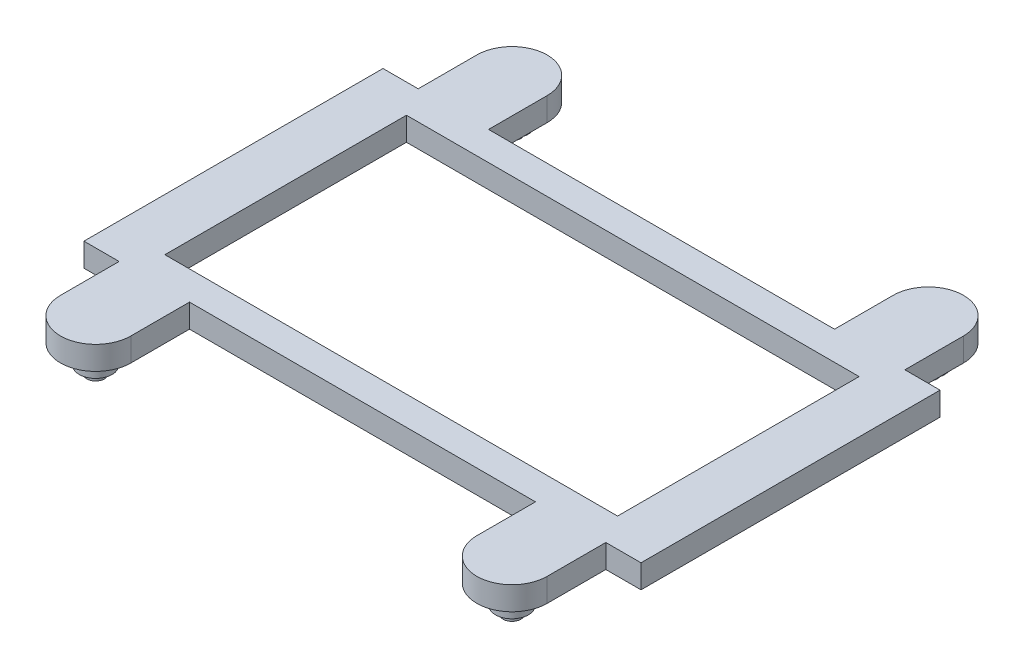
from build123d import *

# Parameters (mm, degrees)
EXTRUDE_1_DEPTH     = 4
SKETCH_4_R          = 2.8
EXTRUDE_2_DEPTH     = 3.3
EXTRUDE_2_2_DEPTH   = 3.3
EXTRUDE_2_3_DEPTH   = 3.3
EXTRUDE_2_4_DEPTH   = 3.3
SKETCH_5_R          = 1.5
EXTRUDE_3_DEPTH     = 1.3
EXTRUDE_3_2_DEPTH   = 1.3
EXTRUDE_3_3_DEPTH   = 1.3
EXTRUDE_3_4_DEPTH   = 1.3
SKETCH_10_W         = 77.2
SKETCH_10_H         = 41.2
CUT_EXTRUDE_5_DEPTH = 64.658934958


with BuildPart() as part:
    # 草图1 → 凸台-拉伸1 (new body)
    with BuildSketch(Plane(origin=(0, 0, 0), x_dir=(1, 0, 0), z_dir=(0, 1, 0))):
        with BuildLine():
            Line((-47.5, 25.5), (-41.5, 25.5))
            Line((-41.5, 25.5), (-41.5, 35.5))
            ThreePointArc((-41.5, 35.5), (-35.5, 41.5), (-29.5, 35.5))
            Line((-29.5, 35.5), (-29.5, 25.5))
            Line((-29.5, 25.5), (-3, 25.5))
            Line((-3, 25.5), (3, 25.5))
            Line((3, 25.5), (29.5, 25.5))
            Line((29.5, 25.5), (29.5, 35.5))
            ThreePointArc((29.5, 35.5), (35.5, 41.5), (41.5, 35.5))
            Line((41.5, 35.5), (41.5, 25.5))
            Line((41.5, 25.5), (47.5, 25.5))
            Line((47.5, 25.5), (47.5, -25.5))
            Line((47.5, -25.5), (41.5, -25.5))
            Line((41.5, -25.5), (41.5, -35.5))
            ThreePointArc((41.5, -35.5), (35.5, -41.5), (29.5, -35.5))
            Line((29.5, -35.5), (29.5, -25.5))
            Line((29.5, -25.5), (3, -25.5))
            Line((3, -25.5), (-3, -25.5))
            Line((-3, -25.5), (-29.5, -25.5))
            Line((-29.5, -25.5), (-29.5, -35.5))
            ThreePointArc((-29.5, -35.5), (-35.5, -41.5), (-41.5, -35.5))
            Line((-41.5, -35.5), (-41.5, -25.5))
            Line((-41.5, -25.5), (-47.5, -25.5))
            Line((-47.5, -25.5), (-47.5, 25.5))
        make_face()
    extrude(amount=-EXTRUDE_1_DEPTH)

    # 草图10 → 切除-拉伸5 (cut, through all)
    with BuildSketch(Plane(origin=(0, 0, 0), x_dir=(1, 0, 0), z_dir=(0, 1, 0))):
        Rectangle(SKETCH_10_W, SKETCH_10_H)
    extrude(amount=-CUT_EXTRUDE_5_DEPTH, mode=Mode.SUBTRACT)


with BuildPart() as body_2:
    # 草图4 → 凸台-拉伸2 (new body)
    with BuildSketch(Plane.XZ.offset(4)):
        with Locations(Location((35.5, 35.5, 0), (0, 0, 90))):
            Circle(SKETCH_4_R)
    extrude(amount=EXTRUDE_2_DEPTH)


with BuildPart() as body_3:
    # 草图4 → Extrude 2 2 (new body)
    with BuildSketch(Plane.XZ.offset(4)):
        with Locations(Location((35.5, -35.5, 0), (0, 0, 270))):
            Circle(SKETCH_4_R)
    extrude(amount=EXTRUDE_2_2_DEPTH)


with BuildPart() as body_4:
    # 草图4 → Extrude 2 3 (new body)
    with BuildSketch(Plane.XZ.offset(4)):
        with Locations(Location((-35.5, -35.5, 0), (0, 0, 90))):
            Circle(SKETCH_4_R)
    extrude(amount=EXTRUDE_2_3_DEPTH)


with BuildPart() as body_5:
    # 草图4 → Extrude 2 4 (new body)
    with BuildSketch(Plane.XZ.offset(4)):
        with Locations(Location((-35.5, 35.5, 0), (0, 0, 270))):
            Circle(SKETCH_4_R)
    extrude(amount=EXTRUDE_2_4_DEPTH)


with BuildPart() as body_6:
    # 草图5 → 凸台-拉伸3 (new body)
    with BuildSketch(Plane.XZ.offset(7.3)):
        with Locations(Location((-35.5, 35.5, 0), (0, 0, 270))):
            Circle(SKETCH_5_R)
    extrude(amount=EXTRUDE_3_DEPTH)


with BuildPart() as body_7:
    # 草图5 → Extrude 3 2 (new body)
    with BuildSketch(Plane.XZ.offset(7.3)):
        with Locations(Location((35.5, 35.5, 0), (0, 0, 90))):
            Circle(SKETCH_5_R)
    extrude(amount=EXTRUDE_3_2_DEPTH)


with BuildPart() as body_8:
    # 草图5 → Extrude 3 3 (new body)
    with BuildSketch(Plane.XZ.offset(7.3)):
        with Locations(Location((35.5, -35.5, 0), (0, 0, 270))):
            Circle(SKETCH_5_R)
    extrude(amount=EXTRUDE_3_3_DEPTH)


with BuildPart() as body_9:
    # 草图5 → Extrude 3 4 (new body)
    with BuildSketch(Plane.XZ.offset(7.3)):
        with Locations(Location((-35.5, -35.5, 0), (0, 0, 90))):
            Circle(SKETCH_5_R)
    extrude(amount=EXTRUDE_3_4_DEPTH)


solid = Compound([part.part, body_2.part, body_3.part, body_4.part, body_5.part, body_6.part, body_7.part, body_8.part, body_9.part])
